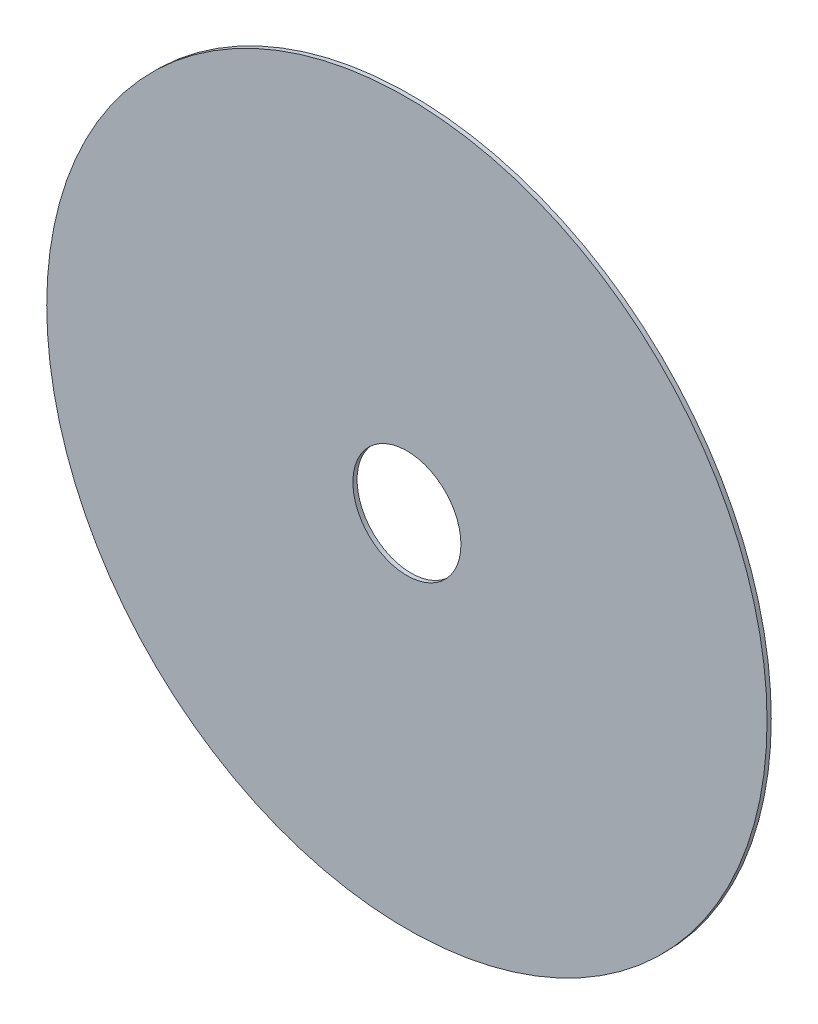
from build123d import *

# Parameters (mm, degrees)
SKETCH1_R           = 15.24
SKETCH1_R_2         = 2.286
BOSS_EXTRUDE1_DEPTH = 0.1778


with BuildPart() as part:
    # Sketch1 → Boss-Extrude1 (new body)
    with BuildSketch(Plane.XY):
        Circle(SKETCH1_R)
        Circle(SKETCH1_R_2, mode=Mode.SUBTRACT)
    extrude(amount=BOSS_EXTRUDE1_DEPTH)


solid = part.part
